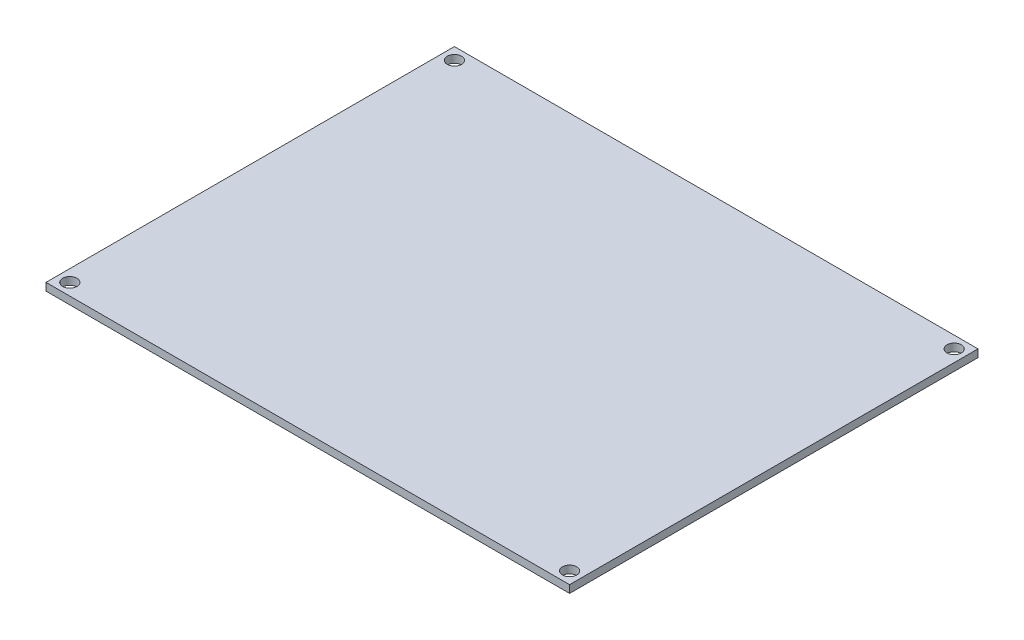
from build123d import *

# Parameters (mm, degrees)
SKETCH1_W           = 110
SKETCH1_H           = 85.8
SKETCH1_R           = 1.5
BOSS_EXTRUDE1_DEPTH = 1.6


with BuildPart() as part:
    # Sketch1 → Boss-Extrude1 (new body)
    with BuildSketch(Plane(origin=(0, 0, 0), x_dir=(1, 0, 0), z_dir=(0, 1, 0))):
        Rectangle(SKETCH1_W, SKETCH1_H)
        with Locations(Location((-52.5, 40.4, 0), (0, 0, 270))):
            Circle(SKETCH1_R, mode=Mode.SUBTRACT)
        with Locations(Location((52.5, 40.4, 0), (0, 0, 90))):
            Circle(SKETCH1_R, mode=Mode.SUBTRACT)
        with Locations(Location((52.5, -40.4, 0), (0, 0, 270))):
            Circle(SKETCH1_R, mode=Mode.SUBTRACT)
        with Locations(Location((-52.5, -40.4, 0), (0, 0, 90))):
            Circle(SKETCH1_R, mode=Mode.SUBTRACT)
    extrude(amount=BOSS_EXTRUDE1_DEPTH)


solid = part.part
